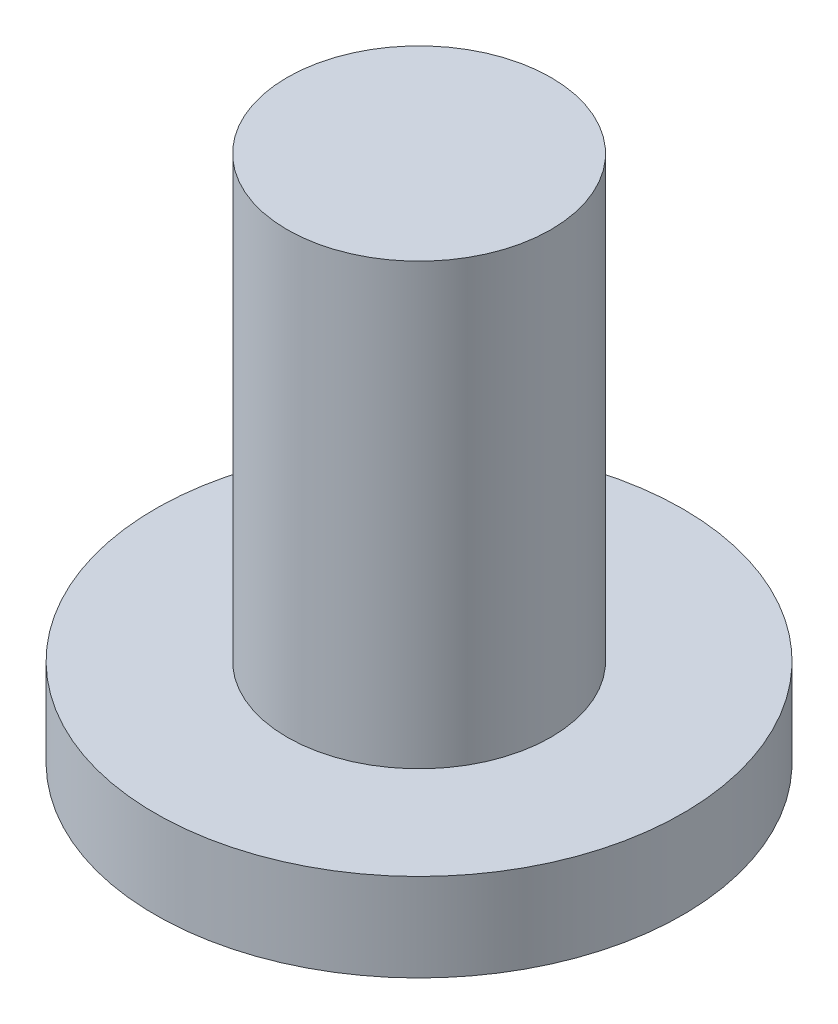
from build123d import *


with BuildPart() as part:
    # Sketch1 → Revolve1 (revolve)
    with BuildSketch(Plane.XY, mode=Mode.PRIVATE) as revolve1_sk:
        Polygon((0, 0), (0, 12), (3, 12), (3, 2), (6, 2), (6, 0), align=None)
    revolve(revolve1_sk.sketch.rotate(Axis((0, 0, 0), (0, 1, 0)), 90), axis=Axis((0, 0, 0), (0, 1, 0)))


solid = part.part
